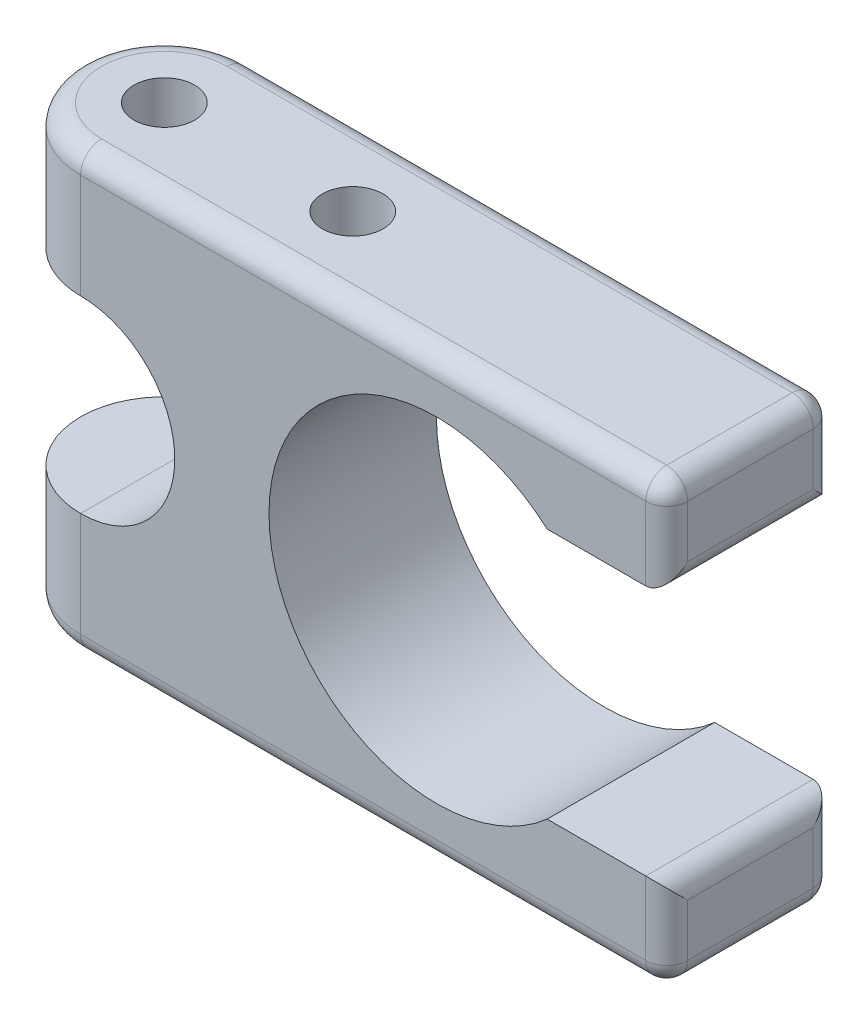
from build123d import *

# Parameters (mm, degrees)
SKETCH1_W                       = 32
SKETCH1_H                       = 21
BOSS_EXTRUDE1_DEPTH             = 8
FILLET1_RADIUS                  = 4
FILLET1_LENGTH                  = 21
CUT_EXTRUDE1_REACH              = 22.742
M2_5_CLEARANCE_HOLE1_AT_2_COUNT = 2
M2_5_CLEARANCE_HOLE1_AT_2_PITCH = 9
FILLET2_R                       = 1
CUT_EXTRUDE2_REACH              = 22.742


with BuildPart() as part:
    # Sketch1 → Boss-Extrude1 (new body)
    with BuildSketch(Plane.XY):
        Rectangle(SKETCH1_W, SKETCH1_H)
    extrude(amount=BOSS_EXTRUDE1_DEPTH)

    # Fillet1: full round fillet: the end face becomes a half cylinder, R = half its width
    fillet1_face = Plane((-16, 0, 4), x_dir=(0, 1, 0), z_dir=(-1, 0, 0))  # on the end face: x along it, z out of the body
    fillet1_slab = fillet1_face.offset(-FILLET1_RADIUS / 2) * Box(FILLET1_LENGTH, 2 * FILLET1_RADIUS, FILLET1_RADIUS, mode=Mode.PRIVATE)  # the body's end, R deep
    fillet1_round = Plane((-12, 0, 4), x_dir=(-1, 0, 0), z_dir=(0, 1, 0)) * Cylinder(FILLET1_RADIUS, FILLET1_LENGTH, mode=Mode.PRIVATE)  # its axis R under the face
    add(fillet1_slab - fillet1_round, mode=Mode.SUBTRACT)

    # Sketch2 → Cut-Extrude1 (cut, up to next)
    with BuildSketch(Plane.XY.offset(8), mode=Mode.PRIVATE) as cut_extrude1_sk1:
        with BuildLine():
            Line((16, 6), (10.291502622, 6))
            ThreePointArc((10.291502622, 6), (-3, 0), (10.291502622, -6))
            Line((10.291502622, -6), (16, -6))
            Line((16, -6), (16, 6))
        make_face()
    cut_extrude1_tool1 = extrude(cut_extrude1_sk1.sketch, amount=-CUT_EXTRUDE1_REACH, mode=Mode.PRIVATE) & part.part
    add(cut_extrude1_tool1.solids().sort_by_distance((6.675863, 0, 8))[0], mode=Mode.SUBTRACT)

    # Sketch5 → M2.5 Clearance Hole1 (revolve, cut)
    with BuildSketch(Plane(origin=(-12, 10.5, 4), x_dir=(0, 0, 1), z_dir=(1, 0, 0))):
        Polygon((0, 0), (0, 4.871247898), (1.45, 4), (1.45, 0), align=None)
    m2_5_clearance_hole1 = revolve(axis=Axis((-12, 16.85, 4), (0, -1, 0)), mode=Mode.SUBTRACT)

    # M2.5 Clearance Hole1 at 2: M2.5 Clearance Hole1 ×2
    with Locations(*[(i * M2_5_CLEARANCE_HOLE1_AT_2_PITCH, 0, 0) for i in range(1, M2_5_CLEARANCE_HOLE1_AT_2_COUNT)]):
        add(m2_5_clearance_hole1, mode=Mode.SUBTRACT)

    # Fillet2
    fillet2_edges = [part.edges().sort_by_distance(p)[0] for p in [
        (16, -8.25, 8),
        (2, 10.5, 8),
        (2, -10.5, 8),
        (2, -10.5, 0),
        (-16, 10.5, 4),
        (-16, -10.5, 4),
        (16, 8.25, 0),
        (16, 8.25, 8),
        (16, 6, 4),
        (16, -6, 4),
        (2, 10.5, 0),
        (16, -8.25, 0),
        (16, 10.5, 4),
        (16, -10.5, 4),
    ]]
    fillet(fillet2_edges, radius=FILLET2_R)

    # Mirror1: M2.5 Clearance Hole1 across plane
    add(m2_5_clearance_hole1.mirror(Plane.ZX), mode=Mode.SUBTRACT)

    # Mirror1 copy 1 sketch → Mirror1 copy 1 (revolve, cut)
    with BuildSketch(Plane(origin=(-3, -10.5, 4), x_dir=(0, 0, 1), z_dir=(1, 0, 0))):
        Polygon((0, 0), (0, -4.871247898), (1.45, -4), (1.45, 0), align=None)
    revolve(axis=Axis((-3, -16.85, 4), (0, -1, 0)), mode=Mode.SUBTRACT)

    # Sketch6 → Cut-Extrude2 (cut, up to next)
    with BuildSketch(Plane.XY, mode=Mode.PRIVATE) as cut_extrude2_sk1:
        with BuildLine():
            Line((-12, 4.5), (-16, 4.5))
            Line((-16, 4.5), (-16, -4.5))
            Line((-16, -4.5), (-12, -4.5))
            ThreePointArc((-12, -4.5), (-7.5, 0), (-12, 4.5))
        make_face()
    cut_extrude2_tool1 = extrude(cut_extrude2_sk1.sketch, amount=CUT_EXTRUDE2_REACH, mode=Mode.PRIVATE) & part.part
    add(cut_extrude2_tool1.solids().sort_by_distance((-12.165908, 0, 0))[0], mode=Mode.SUBTRACT)


solid = part.part
